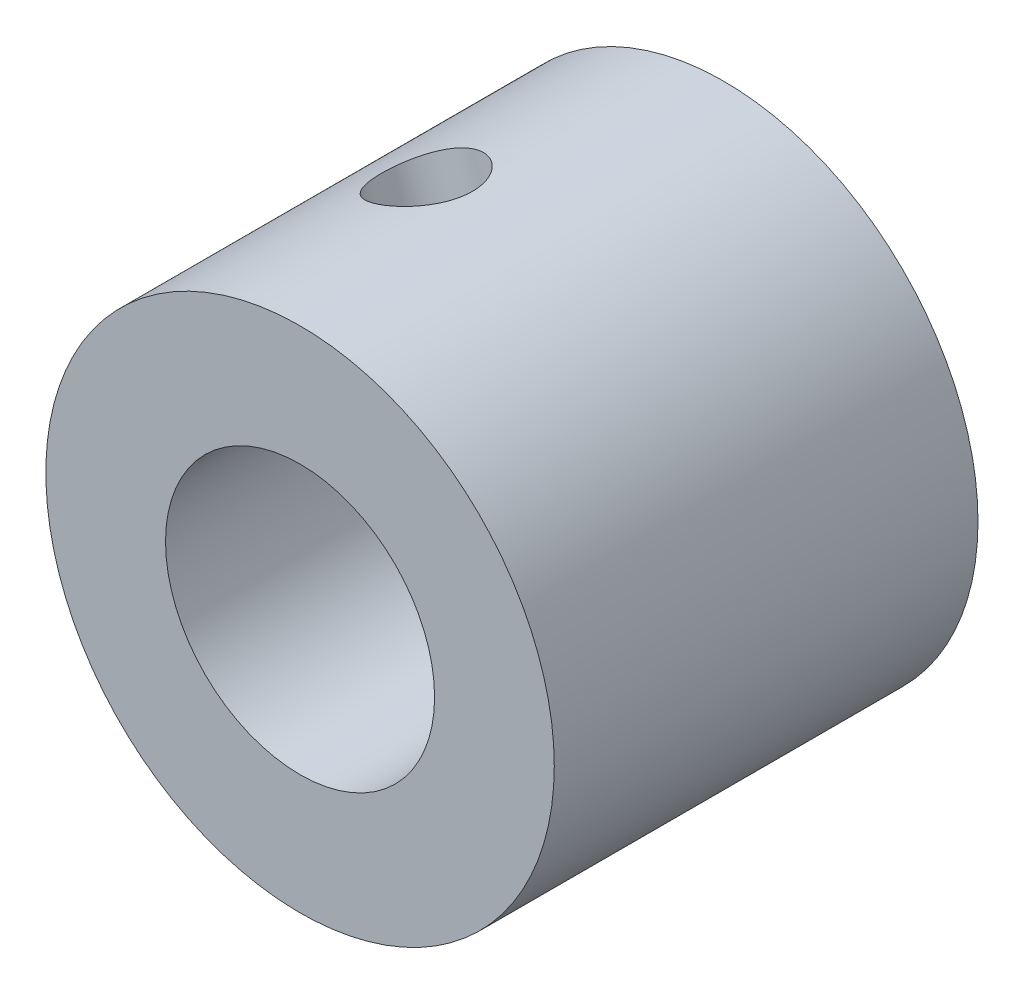
from build123d import *

# Parameters (mm, degrees)
SKETCH1_R                 = 6
SKETCH1_R_2               = 3.175
BOSS_EXTRUDE1_DEPTH       = 10
F_4_40_TAPPED_HOLE1_D     = 2.2606
F_4_40_TAPPED_HOLE1_DEPTH = 5
F_4_40_TAPPED_HOLE1_TIP   = 0.679152758


with BuildPart() as part:
    # Sketch1 → Boss-Extrude1 (new body)
    with BuildSketch(Plane.XY):
        Circle(SKETCH1_R)
        Circle(SKETCH1_R_2, mode=Mode.SUBTRACT)
    extrude(amount=BOSS_EXTRUDE1_DEPTH)

    # #4-40 Tapped Hole1
    with Locations(Plane(origin=(-1.868760364, 5.701555463, 5.170045216), x_dir=(0.950259243894, 0.311460060673, 0), z_dir=(-0.311460060673, 0.950259243894, 0))):
        with Locations((0, 0)):
            Hole(F_4_40_TAPPED_HOLE1_D / 2, depth=F_4_40_TAPPED_HOLE1_DEPTH)
            with Locations((0, 0, -(F_4_40_TAPPED_HOLE1_DEPTH + F_4_40_TAPPED_HOLE1_TIP / 2))):  # 118° drill point
                Cone(0, F_4_40_TAPPED_HOLE1_D / 2, F_4_40_TAPPED_HOLE1_TIP, mode=Mode.SUBTRACT)


solid = part.part
